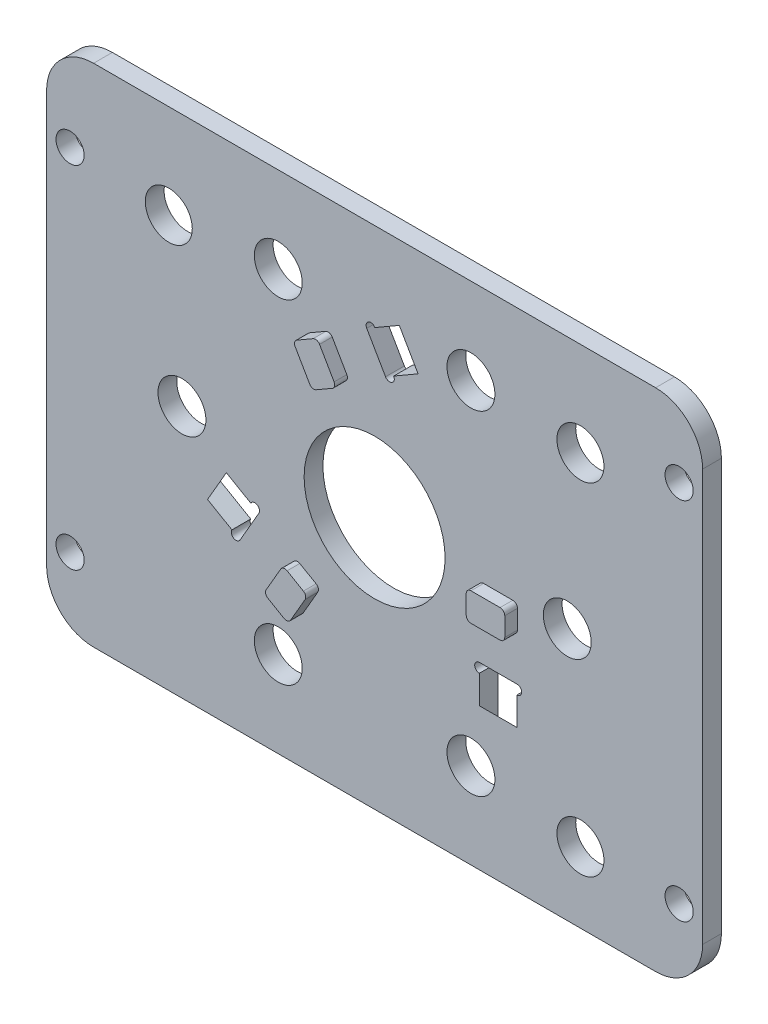
from build123d import *

# Parameters (mm, degrees)
SKETCH_1_W          = 76
SKETCH_1_H          = 60
EXTRUDE_1_DEPTH     = 2
EXTRUDE_2_DEPTH     = 3.35
SKETCH_2_W          = 76
SKETCH_2_H          = 60
CUT_EXTRUDE_1_DEPTH = 2.95
SKETCH_3_R          = 2.55
CUT_EXTRUDE_2_DEPTH = 45.193605611
SKETCH_4_R          = 7.5
CUT_EXTRUDE_3_DEPTH = 45.193605611
SKETCH_5_R          = 1.5
CUT_EXTRUDE_4_DEPTH = 45.193605611
SKETCH_6_R          = 2.5
CUT_EXTRUDE_5_DEPTH = 45.193605611
CUT_EXTRUDE_6_DEPTH = 4
CUT_EXTRUDE_7_DEPTH = 4
CUT_EXTRUDE_8_DEPTH = 4


with BuildPart() as part:
    # 草圖1 → 填料-伸長1 (new body)
    with BuildSketch(Plane.XY):
        Rectangle(SKETCH_1_W, SKETCH_1_H)
        with BuildLine():
            ThreePointArc((-6.225922266, -9.22263808), (-5.992959353, -9.526241259), (-6.042909564, -9.905650781))
            Line((-6.042909564, -9.905650781), (-7.592909564, -12.590329533))
            ThreePointArc((-7.592909564, -12.590329533), (-7.896512744, -12.823292446), (-8.275922266, -12.773342235))
            Line((-8.275922266, -12.773342235), (-10.007973074, -11.773342235))
            ThreePointArc((-10.007973074, -11.773342235), (-10.240935987, -11.469739056), (-10.190985776, -11.090329533))
            Line((-10.190985776, -11.090329533), (-8.640985776, -8.405650781))
            ThreePointArc((-8.640985776, -8.405650781), (-8.337382596, -8.172687868), (-7.957973074, -8.22263808))
            Line((-7.957973074, -8.22263808), (-6.225922266, -9.22263808))
        make_face(mode=Mode.SUBTRACT)
        with BuildLine():
            Line((-12.313100093, -5.76593935), (-14.313100093, -9.230040965))
            ThreePointArc((-14.313100093, -9.230040965), (-14.996112795, -9.413053667), (-15.179125497, -8.730040965))
            Line((-15.179125497, -8.730040965), (-13.179125497, -5.26593935))
            ThreePointArc((-13.179125497, -5.26593935), (-12.496112795, -5.082926648), (-12.313100093, -5.76593935))
        make_face(mode=Mode.SUBTRACT)
        with BuildLine():
            ThreePointArc((11.15, -8.780487805), (10.65, -8.280487805), (11.15, -7.780487805))
            Line((11.15, -7.780487805), (15.15, -7.780487805))
            ThreePointArc((15.15, -7.780487805), (15.65, -8.280487805), (15.15, -8.780487805))
            Line((15.15, -8.780487805), (11.15, -8.780487805))
        make_face(mode=Mode.SUBTRACT)
        with BuildLine():
            Line((-5.557090436, 10.186138586), (-7.107090436, 12.870817338))
            ThreePointArc((-7.107090436, 12.870817338), (-7.157040647, 13.250226861), (-6.924077734, 13.55383004))
            Line((-6.924077734, 13.55383004), (-5.192026926, 14.55383004))
            ThreePointArc((-5.192026926, 14.55383004), (-4.812617404, 14.603780251), (-4.509014224, 14.370817338))
            Line((-4.509014224, 14.370817338), (-2.959014224, 11.686138586))
            ThreePointArc((-2.959014224, 11.686138586), (-2.909064013, 11.306729064), (-3.142026926, 11.003125884))
            Line((-3.142026926, 11.003125884), (-4.874077734, 10.003125884))
            ThreePointArc((-4.874077734, 10.003125884), (-5.253487256, 9.953175673), (-5.557090436, 10.186138586))
        make_face(mode=Mode.SUBTRACT)
        with BuildLine():
            Line((1.163100093, 13.546427155), (-0.836899907, 17.01052877))
            ThreePointArc((-0.836899907, 17.01052877), (-0.653887205, 17.693541472), (0.029125497, 17.51052877))
            Line((0.029125497, 17.51052877), (2.029125497, 14.046427155))
            ThreePointArc((2.029125497, 14.046427155), (1.846112795, 13.363414453), (1.163100093, 13.546427155))
        make_face(mode=Mode.SUBTRACT)
    extrude(amount=EXTRUDE_1_DEPTH)

    # 草圖1<3> → 填料-伸長2 (add)
    with BuildSketch(Plane.XY):
        with BuildLine():
            Line((14.7, -0.280487805), (11.6, -0.280487805))
            ThreePointArc((11.6, -0.280487805), (11.246446609, -0.426934414), (11.1, -0.780487805))
            Line((11.1, -0.780487805), (11.1, -2.780487805))
            ThreePointArc((11.1, -2.780487805), (11.246446609, -3.134041195), (11.6, -3.280487805))
            Line((11.6, -3.280487805), (14.7, -3.280487805))
            ThreePointArc((14.7, -3.280487805), (15.053553391, -3.134041195), (15.2, -2.780487805))
            Line((15.2, -2.780487805), (15.2, -0.780487805))
            ThreePointArc((15.2, -0.780487805), (15.053553391, -0.426934414), (14.7, -0.280487805))
        make_face()
        with BuildLine():
            Line((-7.107090436, 12.870817338), (-5.557090436, 10.186138586))
            ThreePointArc((-5.557090436, 10.186138586), (-5.253487256, 9.953175673), (-4.874077734, 10.003125884))
            Line((-4.874077734, 10.003125884), (-3.142026926, 11.003125884))
            ThreePointArc((-3.142026926, 11.003125884), (-2.909064013, 11.306729064), (-2.959014224, 11.686138586))
            Line((-2.959014224, 11.686138586), (-4.509014224, 14.370817338))
            ThreePointArc((-4.509014224, 14.370817338), (-4.812617404, 14.603780251), (-5.192026926, 14.55383004))
            Line((-5.192026926, 14.55383004), (-6.924077734, 13.55383004))
            ThreePointArc((-6.924077734, 13.55383004), (-7.157040647, 13.250226861), (-7.107090436, 12.870817338))
        make_face()
        with BuildLine():
            Line((-6.042909564, -9.905650781), (-7.592909564, -12.590329533))
            ThreePointArc((-7.592909564, -12.590329533), (-7.896512744, -12.823292446), (-8.275922266, -12.773342235))
            Line((-8.275922266, -12.773342235), (-10.007973074, -11.773342235))
            ThreePointArc((-10.007973074, -11.773342235), (-10.240935987, -11.469739056), (-10.190985776, -11.090329533))
            Line((-10.190985776, -11.090329533), (-8.640985776, -8.405650781))
            ThreePointArc((-8.640985776, -8.405650781), (-8.337382596, -8.172687868), (-7.957973074, -8.22263808))
            Line((-7.957973074, -8.22263808), (-6.225922266, -9.22263808))
            ThreePointArc((-6.225922266, -9.22263808), (-5.992959353, -9.526241259), (-6.042909564, -9.905650781))
        make_face()
    extrude(amount=EXTRUDE_2_DEPTH)

    # 草圖2 → 除料-伸長1 (cut)
    with BuildSketch(Plane(origin=(0, 0, 0), x_dir=(-1, 0, 0), z_dir=(0, 0, -1))):
        Rectangle(SKETCH_2_W, SKETCH_2_H)
        with BuildLine():
            ThreePointArc((-29.9, 26.904317068), (-33.435533906, 25.439850974), (-34.9, 21.904317068))
            Line((-34.9, 21.904317068), (-34.9, -21.9))
            ThreePointArc((-34.9, -21.9), (-33.435533906, -25.435533906), (-29.9, -26.9))
            Line((-29.9, -26.9), (29.9, -26.9))
            ThreePointArc((29.9, -26.9), (33.435533906, -25.435533906), (34.9, -21.9))
            Line((34.9, -21.9), (34.9, 21.904317068))
            ThreePointArc((34.9, 21.904317068), (33.435533906, 25.439850974), (29.9, 26.904317068))
            Line((29.9, 26.904317068), (-29.9, 26.904317068))
        make_face(mode=Mode.SUBTRACT)
    extrude(amount=-CUT_EXTRUDE_1_DEPTH, mode=Mode.SUBTRACT)

    # 草圖3 → 除料-伸長2 (cut, through all)
    with BuildSketch(Plane(origin=(0, 0, 0), x_dir=(-1, 0, 0), z_dir=(0, 0, -1))):
        with Locations((20.5, 0)):
            Circle(SKETCH_3_R)
        with Locations((-20.5, 0)):
            Circle(SKETCH_3_R)
        with Locations((-10.25, -17.753520778)):
            Circle(SKETCH_3_R)
        with Locations((-10.25, 17.753520778)):
            Circle(SKETCH_3_R)
        with Locations((10.25, 17.753520778)):
            Circle(SKETCH_3_R)
        with Locations((10.25, -17.753520778)):
            Circle(SKETCH_3_R)
    extrude(amount=-CUT_EXTRUDE_2_DEPTH, mode=Mode.SUBTRACT)

    # 草圖4 → 除料-伸長3 (cut, through all)
    with BuildSketch(Plane(origin=(0, 0, 0), x_dir=(-1, 0, 0), z_dir=(0, 0, -1))):
        Circle(SKETCH_4_R)
    extrude(amount=-CUT_EXTRUDE_3_DEPTH, mode=Mode.SUBTRACT)

    # 草圖5 → 除料-伸長4 (cut, through all)
    with BuildSketch(Plane(origin=(0, 0, 0), x_dir=(-1, 0, 0), z_dir=(0, 0, -1))):
        with Locations((-32.4, 19.404317068)):
            Circle(SKETCH_5_R)
        with Locations(Location((-32.402400032, -19.400309097, 0), (0, 0, 180))):
            Circle(SKETCH_5_R)
        with Locations((32.402400032, -19.400309097)):
            Circle(SKETCH_5_R)
        with Locations((32.402400032, 17.904317068)):
            Circle(SKETCH_5_R)
    extrude(amount=-CUT_EXTRUDE_4_DEPTH, mode=Mode.SUBTRACT)

    # 草圖6 → 除料-伸長5 (cut, through all)
    with BuildSketch(Plane(origin=(0, 0, 0), x_dir=(-1, 0, 0), z_dir=(0, 0, -1))):
        with Locations((-21.9, 16.904317068)):
            Circle(SKETCH_6_R)
        with Locations(Location((21.9, 16.904317068, 0), (0, 0, 180))):
            Circle(SKETCH_6_R)
        with Locations((-21.9, -19.4)):
            Circle(SKETCH_6_R)
    extrude(amount=-CUT_EXTRUDE_5_DEPTH, mode=Mode.SUBTRACT)

    # 草圖7 → 除料-伸長6 (cut)
    with BuildSketch(Plane.ZY.offset(-11.15)):
        Polygon((2, -8.780487805), (0, -8.780487805), (0, -13.780487805), (2, -11.780487805), align=None)
    extrude(amount=-CUT_EXTRUDE_6_DEPTH, mode=Mode.SUBTRACT)

    # 草圖8 → 除料-伸長7 (cut)
    with BuildSketch(Plane(origin=(-5.575, 9.656183252, 0), x_dir=(-0.8660254037844417, -0.4999999999999947, 0), z_dir=(0.49999999999999484, -0.8660254037844418, 0))):
        Polygon((-8.780487805, -2), (-8.780487805, 0), (-13.780487805, 0), (-11.780487805, -2), align=None)
    extrude(amount=-CUT_EXTRUDE_7_DEPTH, mode=Mode.SUBTRACT)

    # 草圖9 → 除料-伸長8 (cut)
    with BuildSketch(Plane(origin=(-5.575, -9.656183252, 0), x_dir=(0.8660254037844359, -0.5000000000000049, 0), z_dir=(0.5000000000000048, 0.8660254037844358, 0))):
        Polygon((-8.780487805, -2), (-8.780487805, 0), (-13.780487805, 0), (-11.780487805, -2), align=None)
    extrude(amount=-CUT_EXTRUDE_8_DEPTH, mode=Mode.SUBTRACT)


solid = part.part
